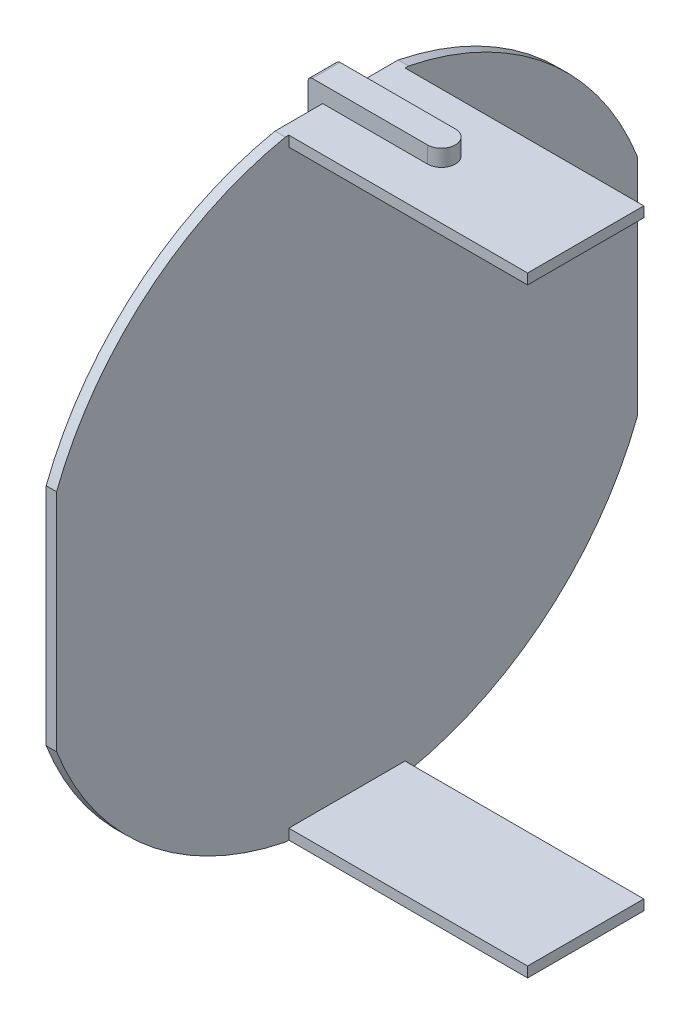
from build123d import *

# Parameters (mm, degrees)
ESBO_O1_R                   = 7.5
RESSALTO_EXTRUS_O1_DEPTH    = 6
ESBO_O2_W                   = 3
ESBO_O2_H                   = 0.472136223
CORTE_EXTRUS_O1_DEPTH       = 6
ESBO_O3_W                   = 2.966826726
ESBO_O3_H                   = 0.25
RESSALTO_EXTRUS_O2_DEPTH    = 5.75
ESBO_O4_W                   = 22.809874316
ESBO_O4_H                   = 14.203670942
CORTE_EXTRUS_O2_DEPTH       = 5.75
ESBO_O5_W                   = 7.250675024
ESBO_O5_H                   = 15.25065993
CORTE_EXTRUS_O3_DEPTH       = 10.75
RESSALTO_EXTRUS_O3_DEPTH    = 0.35
RESSALTO_EXTRUS_O4_DEPTH    = 0.35
CORTE_EXTRUS_O5_DEPTH       = 16
CORTE_EXTRUS_O5_DEPTH_BACK  = 6.35
CORTE_EXTRUS_O6_DEPTH       = 7.35
CORTE_EXTRUS_O6_DEPTH_BACK  = 13
FILETE1_R                   = 0.1
RESSALTO_EXTRUS_O5_DEPTH    = 0.4
CORTE_EXTRUS_O7_DEPTH       = 0.4
ESBO_O14_W                  = 0.349889087
ESBO_O14_H                  = 0.668418636
RESSALTO_EXTRUS_O6_DEPTH    = 2.4
FILETE2_R                   = 0.1
CORTE_EXTRUS_O9_DEPTH       = 0.35
CORTE_EXTRUS_O10_DEPTH      = 15
CORTE_EXTRUS_O10_DEPTH_BACK = 7.35


with BuildPart() as part:
    # Esboço1 → Ressalto-extrusão1 (new body)
    with BuildSketch(Plane(origin=(0, 0, 0), x_dir=(0, 0, -1), z_dir=(1, 0, 0))):
        Circle(ESBO_O1_R)
    extrude(amount=RESSALTO_EXTRUS_O1_DEPTH)

    # Esboço2 → Corte-extrusão1 (cut)
    with BuildSketch(Plane.ZY):
        with Locations((0, 7.587903583)):
            Rectangle(ESBO_O2_W, ESBO_O2_H)
        with Locations((0, -7.587903583)):
            Rectangle(ESBO_O2_W, ESBO_O2_H)
    extrude(amount=-CORTE_EXTRUS_O1_DEPTH, mode=Mode.SUBTRACT)

    # Esboço3 → Ressalto-extrusão2 (add)
    with BuildSketch(Plane.ZY):
        with Locations((0, 7.226835471)):
            Rectangle(ESBO_O3_W, ESBO_O3_H)
        with Locations((0, -7.226835471)):
            Rectangle(ESBO_O3_W, ESBO_O3_H)
    extrude(amount=-RESSALTO_EXTRUS_O2_DEPTH)

    # Esboço4 → Corte-extrusão2 (cut)
    with BuildSketch(Plane(origin=(6, 0, 0), x_dir=(0, 0, -1), z_dir=(1, 0, 0))):
        Rectangle(ESBO_O4_W, ESBO_O4_H)
    extrude(amount=-CORTE_EXTRUS_O2_DEPTH, mode=Mode.SUBTRACT)

    # Esboço5 → Corte-extrusão3 (cut)
    with BuildSketch(Plane(origin=(0.25, 0, 0), x_dir=(0, 0, -1), z_dir=(1, 0, 0))):
        with Locations((5.024783907, 0)):
            Rectangle(ESBO_O5_W, ESBO_O5_H)
        Polygon((-1.399446395, -7.625329965), (-1.399446395, 7.625329965), (-5.165706312, 7.393925443), (-6.710731139, 7.999984905), (-9.487585404, 6.78786598), (-11.382898632, -7.206597972), align=None)
    extrude(amount=CORTE_EXTRUS_O3_DEPTH, mode=Mode.SUBTRACT)

    # Esboço6 → Ressalto-extrusão3 (add)
    with BuildSketch(Plane.XZ.offset(7.351835471)):
        with BuildLine():
            Line((-2.543494754, 0.321961033), (2.543494754, 0.321961033))
            ThreePointArc((2.543494754, 0.321961033), (2.865455786, 0), (2.543494754, -0.321961033))
            Line((2.543494754, -0.321961033), (-2.543494754, -0.321961033))
            ThreePointArc((-2.543494754, -0.321961033), (-2.865455786, 0), (-2.543494754, 0.321961033))
        make_face()
    extrude(amount=RESSALTO_EXTRUS_O3_DEPTH)

    # Esboço8 → Ressalto-extrusão4 (add)
    with BuildSketch(Plane.ZY):
        with BuildLine():
            Line((-0.314307146, -9.305679126), (-0.314307146, -5.397991816))
            ThreePointArc((-0.314307146, -5.397991816), (0, -5.08368467), (0.314307146, -5.397991816))
            Line((0.314307146, -5.397991816), (0.314307146, -9.305679126))
            ThreePointArc((0.314307146, -9.305679126), (0, -9.619986272), (-0.314307146, -9.305679126))
        make_face()
    extrude(amount=RESSALTO_EXTRUS_O4_DEPTH)

    # Esboço9 → Corte-extrusão5 (cut, two sides: drawn at the far end of the back side and taken through both)
    with BuildSketch(Plane(origin=(0, 0, -0.321961033), x_dir=(-1, 0, 0), z_dir=(0, 0, -1)).offset(-CORTE_EXTRUS_O5_DEPTH_BACK)):
        Polygon((0.35, -7.701835471), (0.35, -4.813290401), (3.812040174, -6.789850405), (3.701673879, -8.068450161), (1.08322938, -8.435064851), align=None)
    extrude(amount=CORTE_EXTRUS_O5_DEPTH + CORTE_EXTRUS_O5_DEPTH_BACK, mode=Mode.SUBTRACT)

    # Esboço10 → Corte-extrusão6 (cut, two sides: drawn at the far end of the back side and taken through both)
    with BuildSketch(Plane(origin=(0, 0, -0.314307146), x_dir=(-1, 0, 0), z_dir=(0, 0, -1)).offset(-CORTE_EXTRUS_O6_DEPTH_BACK)):
        Polygon((-0.161358156, -7.701835471), (0.859566955, -7.701835471), (0.859566955, -10.409050105), (-1.096747377, -10.331004379), align=None)
    extrude(amount=CORTE_EXTRUS_O6_DEPTH + CORTE_EXTRUS_O6_DEPTH_BACK, mode=Mode.SUBTRACT)

    # Filete1
    filete1_edges = [part.edges().sort_by_distance(p)[0] for p in [
        (-0.35, -7.701835471, 0),
    ]]
    fillet(filete1_edges, radius=FILETE1_R)

    # Esboço11 → Ressalto-extrusão5 (add)
    with BuildSketch(Plane(origin=(0, 7.351835471, 0), x_dir=(1, 0, 0), z_dir=(0, 1, 0))):
        with BuildLine():
            Line((-2.525437349, 0.334209318), (2.525437349, 0.334209318))
            ThreePointArc((2.525437349, 0.334209318), (2.859646667, 0), (2.525437349, -0.334209318))
            Line((2.525437349, -0.334209318), (-2.525437349, -0.334209318))
            ThreePointArc((-2.525437349, -0.334209318), (-2.859646667, 0), (-2.525437349, 0.334209318))
        make_face()
    extrude(amount=RESSALTO_EXTRUS_O5_DEPTH)

    # Esboço13 → Corte-extrusão7 (cut)
    with BuildSketch(Plane(origin=(0, 7.751835471, 0), x_dir=(1, 0, 0), z_dir=(0, 1, 0))):
        Polygon((-0.349889087, -0.334209318), (-0.349889087, 0.540947425), (-0.764471769, 0.572838401), (-3.134268128, 0.417702141), (-3.23158757, -0.84745061), (0, -1.013091695), align=None)
    extrude(amount=-CORTE_EXTRUS_O7_DEPTH, mode=Mode.SUBTRACT)

    # Esboço14 → Ressalto-extrusão6 (add)
    with BuildSketch(Plane.XZ.offset(-7.351835471)):
        with Locations((-0.174944544, 0)):
            Rectangle(ESBO_O14_W, ESBO_O14_H)
    extrude(amount=RESSALTO_EXTRUS_O6_DEPTH)

    # Filete2
    filete2_edges = [part.edges().sort_by_distance(p)[0] for p in [
        (-0.349889087, 7.751835471, 0),
    ]]
    fillet(filete2_edges, radius=FILETE2_R)

    # Esboço15 → Corte-extrusão9 (cut)
    with BuildSketch(Plane.ZY.offset(0.349889087)):
        with BuildLine():
            Line((-0.334209318, 5.181370585), (-0.740677409, 5.181370585))
            Line((-0.740677409, 5.181370585), (-0.537443364, 4.71563988))
            Line((-0.537443364, 4.71563988), (0.580990807, 4.526830135))
            Line((0.580990807, 4.526830135), (0.857911766, 4.947135876))
            Line((0.857911766, 4.947135876), (0.334209318, 5.181370585))
            ThreePointArc((0.334209318, 5.181370585), (0, 4.947135876), (-0.334209318, 5.181370585))
        make_face()
    extrude(amount=-CORTE_EXTRUS_O9_DEPTH, mode=Mode.SUBTRACT)

    # Esboço19 → Corte-extrusão10 (cut, two sides: drawn at the far end of the back side and taken through both)
    with BuildSketch(Plane(origin=(0.25, 0, 0), x_dir=(0, 0, -1), z_dir=(1, 0, 0)).offset(-CORTE_EXTRUS_O10_DEPTH_BACK)):
        Polygon((-6.992682683, 8.188928042), (-12.721348099, -3.80184127), (-6.992682683, -8.188928042), align=None)
        Polygon((6.992682683, -8.188928042), (6.992682683, 8.188928042), (11.074646704, 2.193543386), align=None)
    extrude(amount=CORTE_EXTRUS_O10_DEPTH + CORTE_EXTRUS_O10_DEPTH_BACK, mode=Mode.SUBTRACT)


solid = part.part
